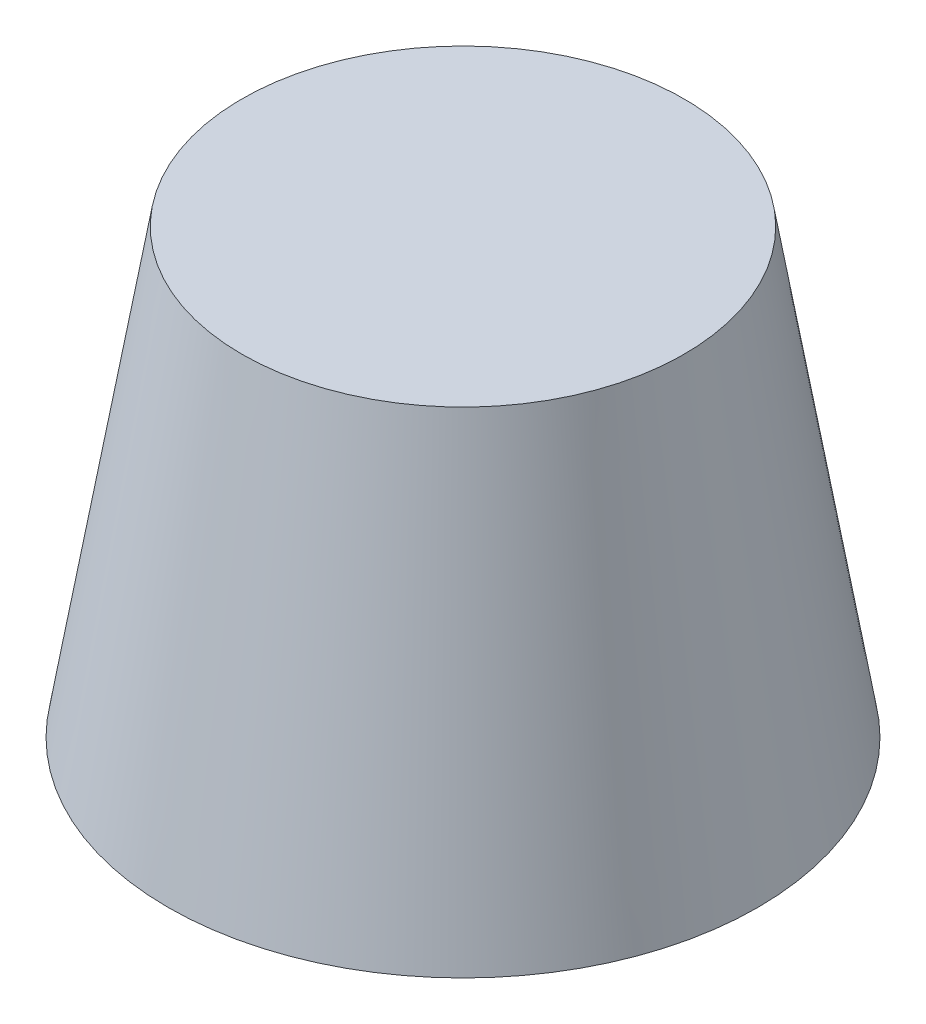
from build123d import *

# Parameters (mm, degrees)
SKETCH1_R          = 6
SKETCH2_R          = 8
CUT_EXTRUDE1_DEPTH = 10


with BuildPart() as part:
    # Sketch1 → Loft1 section 0
    with BuildSketch(Plane(origin=(0, 0, 0), x_dir=(1, 0, 0), z_dir=(0, 1, 0))):
        Circle(SKETCH1_R)
    # Sketch2 → Loft1 section 1
    with BuildSketch(Plane(origin=(0, -12, 0), x_dir=(1, 0, 0), z_dir=(0, 1, 0))):
        Circle(SKETCH2_R)
    loft()

    # Sketch4 → Cut-Extrude1 (cut)
    with BuildSketch(Plane.XZ.offset(12)):
        with BuildLine():
            ThreePointArc((3.15, 0), (-0.801366085, 3.046360517), (-2.74226184, -1.55))
            Line((-2.74226184, -1.55), (2.74226184, -1.55))
            ThreePointArc((2.74226184, -1.55), (3.046360517, -0.801366085), (3.15, 0))
        make_face()
    extrude(amount=-CUT_EXTRUDE1_DEPTH, mode=Mode.SUBTRACT)


solid = part.part
